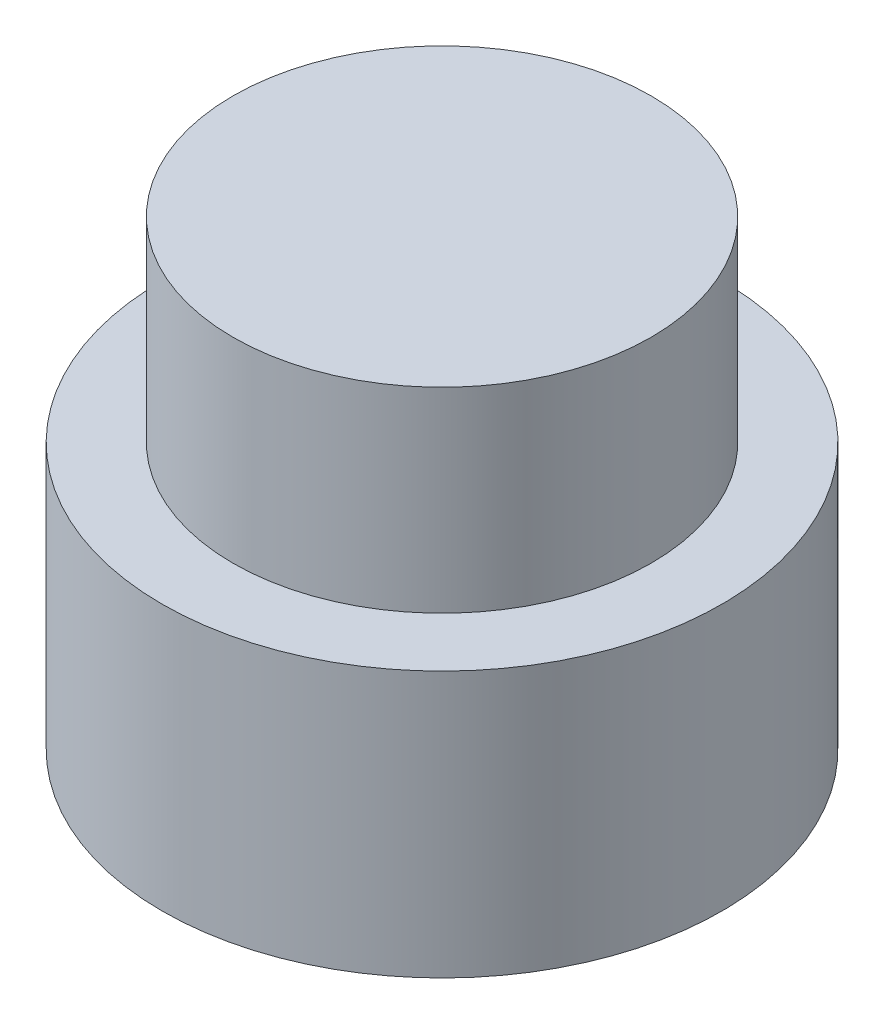
from build123d import *

# Parameters (mm, degrees)
SKETCH2_R          = 2.5
CUT_EXTRUDE1_DEPTH = 10


with BuildPart() as part:
    # Sketch1 → Revolve1 (revolve)
    with BuildSketch(Plane.XY, mode=Mode.PRIVATE) as revolve1_sk:
        Polygon((0, 0), (7.9, 0), (7.9, 7.5), (5.9, 7.5), (5.9, 13.022374429), (0, 13.022374429), align=None)
    revolve(revolve1_sk.sketch.rotate(Axis((0, 13.022374429, 0), (0, -1, 0)), 90), axis=Axis((0, 13.022374429, 0), (0, -1, 0)))

    # Sketch2 → Cut-Extrude1 (cut)
    with BuildSketch(Plane.XZ):
        with Locations(Location((0, 0, 0), (0, 0, 270))):
            Circle(SKETCH2_R)
    extrude(amount=-CUT_EXTRUDE1_DEPTH, mode=Mode.SUBTRACT)


solid = part.part
